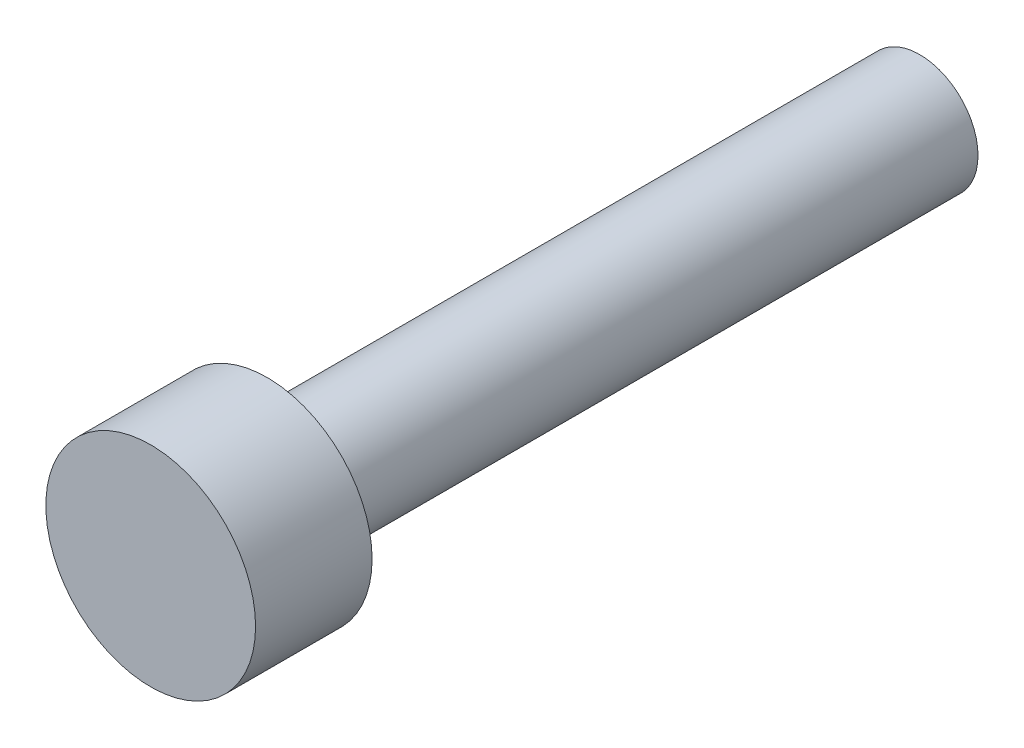
from build123d import *

# Parameters (mm, degrees)
SHANK_NOMINAL_THREAD_ENVELOPE_START     = -14
SHANK_NOMINAL_THREAD_ENVELOPE_PROFILE_R = 1.25
SHANK_NOMINAL_THREAD_ENVELOPE_DEPTH     = 14
SOCKET_HEAD_ENVELOPE_PROFILE_R          = 2.25
SOCKET_HEAD_ENVELOPE_DEPTH              = 2.5


with BuildPart() as part:
    # Shank_nominal_thread_envelope_profile → Shank_nominal_thread_envelope (new body)
    with BuildSketch(Plane.XY.offset(SHANK_NOMINAL_THREAD_ENVELOPE_START)):
        Circle(SHANK_NOMINAL_THREAD_ENVELOPE_PROFILE_R)
    extrude(amount=SHANK_NOMINAL_THREAD_ENVELOPE_DEPTH)

    # Socket_head_envelope_profile → Socket_head_envelope (add)
    with BuildSketch(Plane.XY):
        Circle(SOCKET_HEAD_ENVELOPE_PROFILE_R)
    extrude(amount=SOCKET_HEAD_ENVELOPE_DEPTH)


solid = part.part
